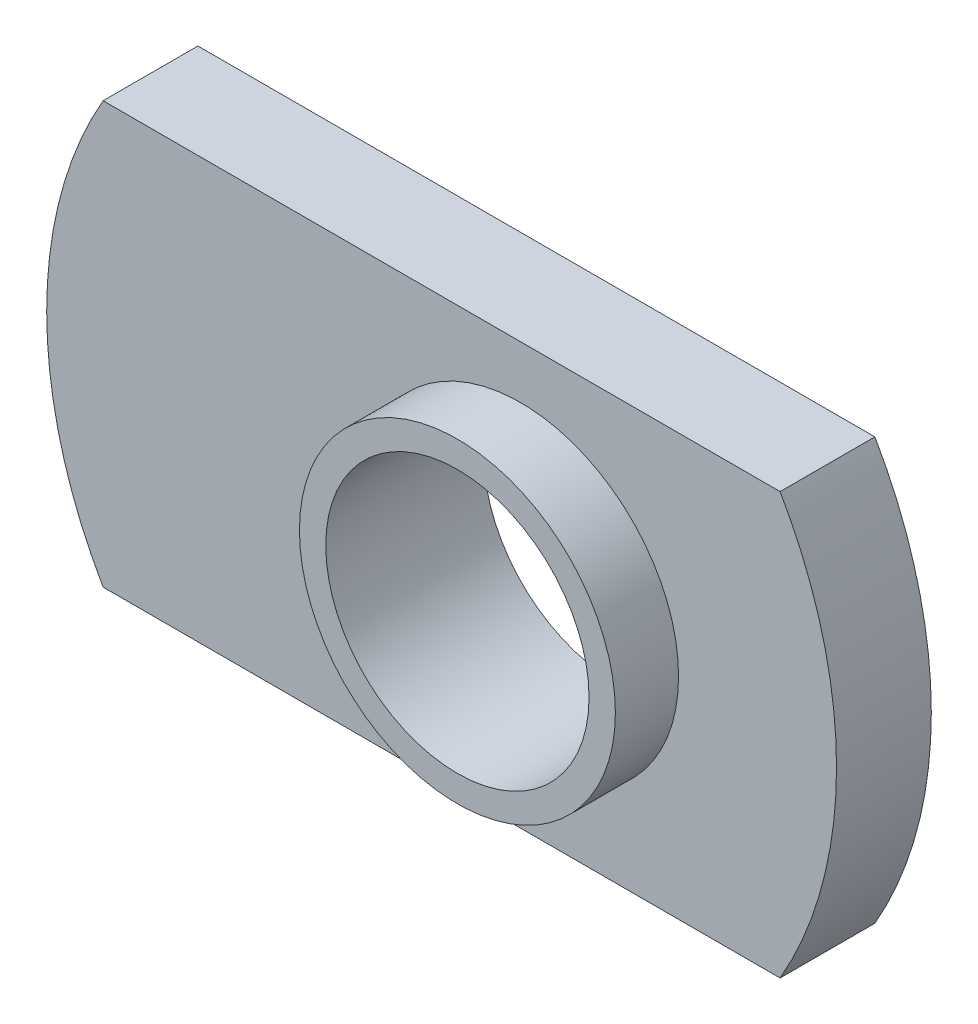
from build123d import *

# Parameters (mm, degrees)
BOSS_EXTRUDE1_DEPTH     = 0.9
SKETCH8_R               = 3
SKETCH8_R_2             = 2.5
BOSS_EXTRUDE2_DEPTH     = 1.2
CUT_EXTRUDE1_DEPTH      = 11.070253224
CUT_EXTRUDE1_DEPTH_BACK = 11.070253224
SKETCH1_R               = 2.5


with BuildPart() as part:
    # Sketch7 → Boss-Extrude1 (new, symmetric)
    with BuildSketch(Plane.XY):
        with BuildLine():
            Line((-7.92820323, 4), (4.92820323, 4))
            ThreePointArc((4.92820323, 4), (6, 0), (4.92820323, -4))
            Line((4.92820323, -4), (-7.92820323, -4))
            ThreePointArc((-7.92820323, -4), (-9, 0), (-7.92820323, 4))
        make_face()
    extrude(amount=BOSS_EXTRUDE1_DEPTH, both=True)

    # Sketch8 → Boss-Extrude2 (add)
    with BuildSketch(Plane.XY.offset(0.9)):
        with Locations(Location((0, 0, 0), (0, 0, 180))):
            Circle(SKETCH8_R)
        Circle(SKETCH8_R_2, mode=Mode.SUBTRACT)
    extrude(amount=BOSS_EXTRUDE2_DEPTH)

    # Sketch1 → Cut-Extrude1 (cut, two sides: drawn at the far end of the back side and taken through both)
    with BuildSketch(Plane.XY.offset(-CUT_EXTRUDE1_DEPTH_BACK)):
        Circle(SKETCH1_R)
    extrude(amount=CUT_EXTRUDE1_DEPTH + CUT_EXTRUDE1_DEPTH_BACK, mode=Mode.SUBTRACT)


solid = part.part
